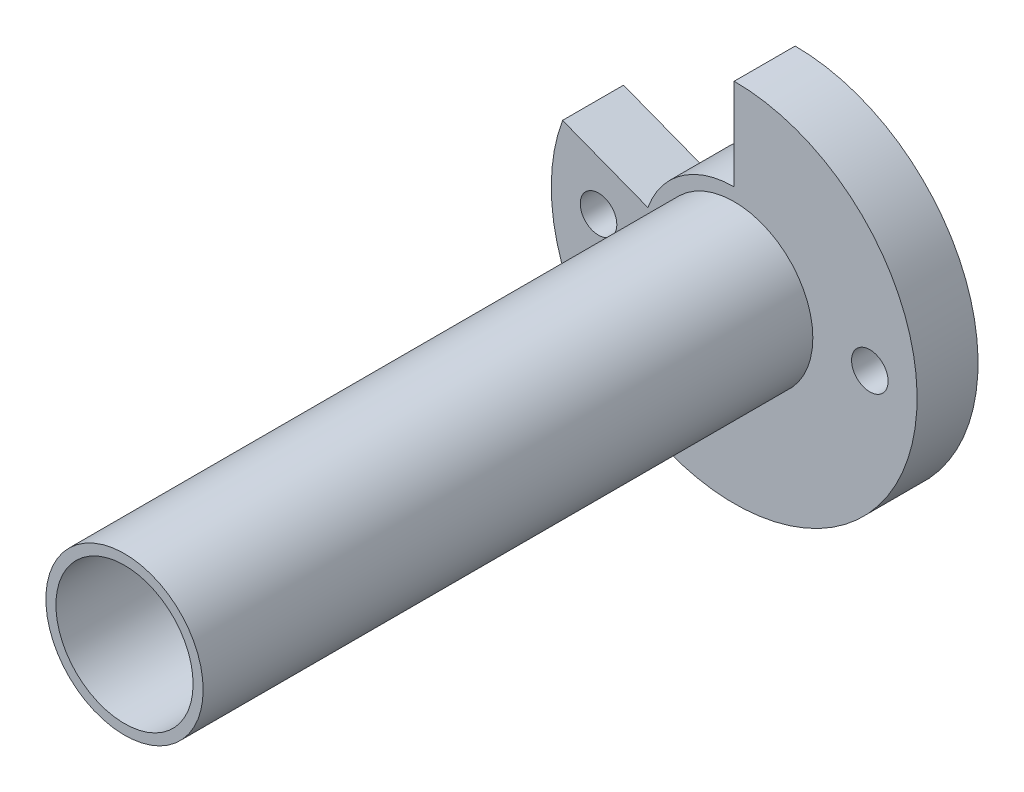
from build123d import *

# Parameters (mm, degrees)
SKETCH1_R                 = 30
BOSS_EXTRUDE1_DEPTH       = 10
SKETCH2_R                 = 12.9
BOSS_EXTRUDE2_DEPTH       = 50
F_6_0MM_DOWEL_HOLE1_D     = 6
CUT_EXTRUDE2_START        = -50
CUT_EXTRUDE2_DEPTH        = 50
F_2_5MM_DOWEL_HOLE1_D     = 2.5
F_2_5MM_DOWEL_HOLE1_DEPTH = 5
SKETCH15_R                = 12.9
SKETCH15_R_2              = 11.25
BOSS_EXTRUDE3_DEPTH       = 50
F_6_0MM_DOWEL_HOLE2_D     = 20


with BuildPart() as part:
    # Sketch1 → Boss-Extrude1 (new body)
    with BuildSketch(Plane.XY):
        Circle(SKETCH1_R)
    extrude(amount=BOSS_EXTRUDE1_DEPTH)

    # Sketch2 → Boss-Extrude2 (add)
    with BuildSketch(Plane.XY.offset(10)):
        Circle(SKETCH2_R)
    extrude(amount=BOSS_EXTRUDE2_DEPTH)

    # Ø6.0mm Dowel Hole1 (through all)
    with Locations(Plane.XY.offset(10)):
        with Locations((-22.25, 0), (22.25, 0)):
            Hole(F_6_0MM_DOWEL_HOLE1_D / 2)

    # Sketch7 → Cut-Extrude2 (cut)
    with BuildSketch(Plane.XY.offset(10).offset(CUT_EXTRUDE2_START)):
        with BuildLine():
            Line((0, 15), (0, 30))
            ThreePointArc((0, 30), (-17.161157118, 24.606801628), (-28.152079261, 10.366312424))
            Line((-28.152079261, 10.366312424), (-14.149156244, 4.98009815))
            ThreePointArc((-14.149156244, 4.98009815), (-8.668867508, 12.241353525), (0, 15))
        make_face()
    extrude(amount=CUT_EXTRUDE2_DEPTH, mode=Mode.SUBTRACT)

    # Ø2.5mm Dowel Hole1
    with Locations(Plane(origin=(0, 0, 0), x_dir=(-1, 0, 0), z_dir=(0, 0, -1))):
        with Locations((-15.733125881, 15.733125881), (-15.733125881, -15.733125881), (15.733125881, -15.733125881)):
            Hole(F_2_5MM_DOWEL_HOLE1_D / 2, depth=F_2_5MM_DOWEL_HOLE1_DEPTH)

    # Sketch15 → Boss-Extrude3 (add)
    with BuildSketch(Plane.XY.offset(60)):
        Circle(SKETCH15_R)
        Circle(SKETCH15_R_2, mode=Mode.SUBTRACT)
    extrude(amount=BOSS_EXTRUDE3_DEPTH)

    # Ø6.0mm Dowel Hole2 (through all)
    with Locations(Plane(origin=(0, 0, 0), x_dir=(-1, 0, 0), z_dir=(0, 0, -1))):
        with Locations((0, 0)):
            Hole(F_6_0MM_DOWEL_HOLE2_D / 2)


solid = part.part
